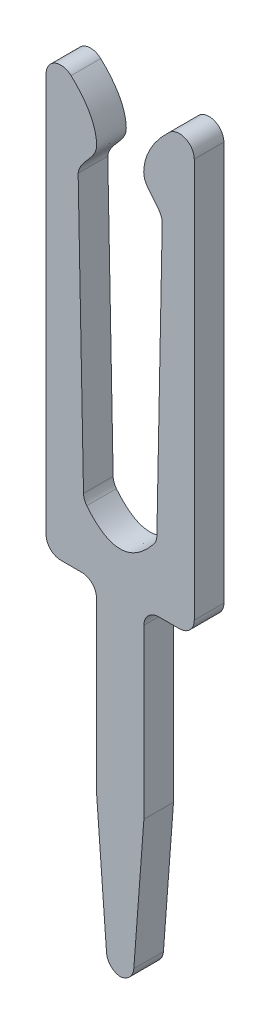
from build123d import *

# Parameters (mm, degrees)
BOSS_EXTRUDE1_DEPTH = 0.2


with BuildPart() as part:
    # Sketch1 → Boss-Extrude1 (new, symmetric)
    with BuildSketch(Plane.XY):
        with BuildLine():
            Line((-0.32, 1.999393664), (-0.32, 4.266775148))
            ThreePointArc((-0.32, 4.266775148), (-0.378578644, 4.408196504), (-0.52, 4.466775148))
            Line((-0.52, 4.466775148), (-0.8, 4.466775148))
            ThreePointArc((-0.8, 4.466775148), (-0.941421356, 4.525353792), (-1, 4.666775148))
            Line((-1, 4.666775148), (-1, 10.057198685))
            ThreePointArc((-1, 10.057198685), (-0.87939743, 10.240763518), (-0.663039519, 10.202944445))
            add(Edge.make_bspline(
                [(-0.663039519, 10.202944445), (-0.487599251, 10.038079386), (-0.326177604, 9.816155039), (-0.310671132, 9.388247389), (-0.548453888, 9.275984696), (-0.567669208, 9.108344969)],
                knots=[0.253308427, 0.253308427, 0.253308427, 0.253308427, 0.663171976, 0.707067436, 1, 1, 1, 1], degree=3))
            Line((-0.567669208, 9.108344969), (-0.495215905, 5.401684718))
            ThreePointArc((-0.495215905, 5.401684718), (-0.483221967, 5.337269967), (-0.451053839, 5.280188217))
            add(Edge.make_bspline(
                [(-0.451053839, 5.280188217), (0, 4.719811783), (0.451053839, 5.280188217)],
                knots=[0.043404734, 0.043404734, 0.043404734, 0.956595266, 0.956595266, 0.956595266], degree=2))
            ThreePointArc((0.451053839, 5.280188217), (0.483221967, 5.337269967), (0.495215905, 5.401684718))
            Line((0.495215905, 5.401684718), (0.567669208, 9.108344969))
            add(Edge.make_bspline(
                [(0.663039519, 10.202944445), (0.487599251, 10.038079386), (0.326177604, 9.816155039), (0.310671132, 9.388247389), (0.548453888, 9.275984696), (0.567669208, 9.108344969)],
                knots=[0.253308427, 0.253308427, 0.253308427, 0.253308427, 0.663171976, 0.707067436, 1, 1, 1, 1], degree=3))
            ThreePointArc((0.663039519, 10.202944445), (0.87939743, 10.240763518), (1, 10.057198685))
            Line((1, 10.057198685), (1, 4.666775148))
            ThreePointArc((1, 4.666775148), (0.941421356, 4.525353792), (0.8, 4.466775148))
            Line((0.8, 4.466775148), (0.52, 4.466775148))
            ThreePointArc((0.52, 4.466775148), (0.378578644, 4.408196504), (0.32, 4.266775148))
            Line((0.32, 4.266775148), (0.32, 1.999393664))
            Line((0.32, 1.999393664), (0.183878151, 0.184435674))
            ThreePointArc((0.183878151, 0.184435674), (0.126073555, 0.058186541), (0, 0))
            ThreePointArc((0, 0), (-0.126073555, 0.058186541), (-0.183878151, 0.184435674))
            Line((-0.183878151, 0.184435674), (-0.32, 1.999393664))
        make_face()
    extrude(amount=BOSS_EXTRUDE1_DEPTH, both=True)


solid = part.part
